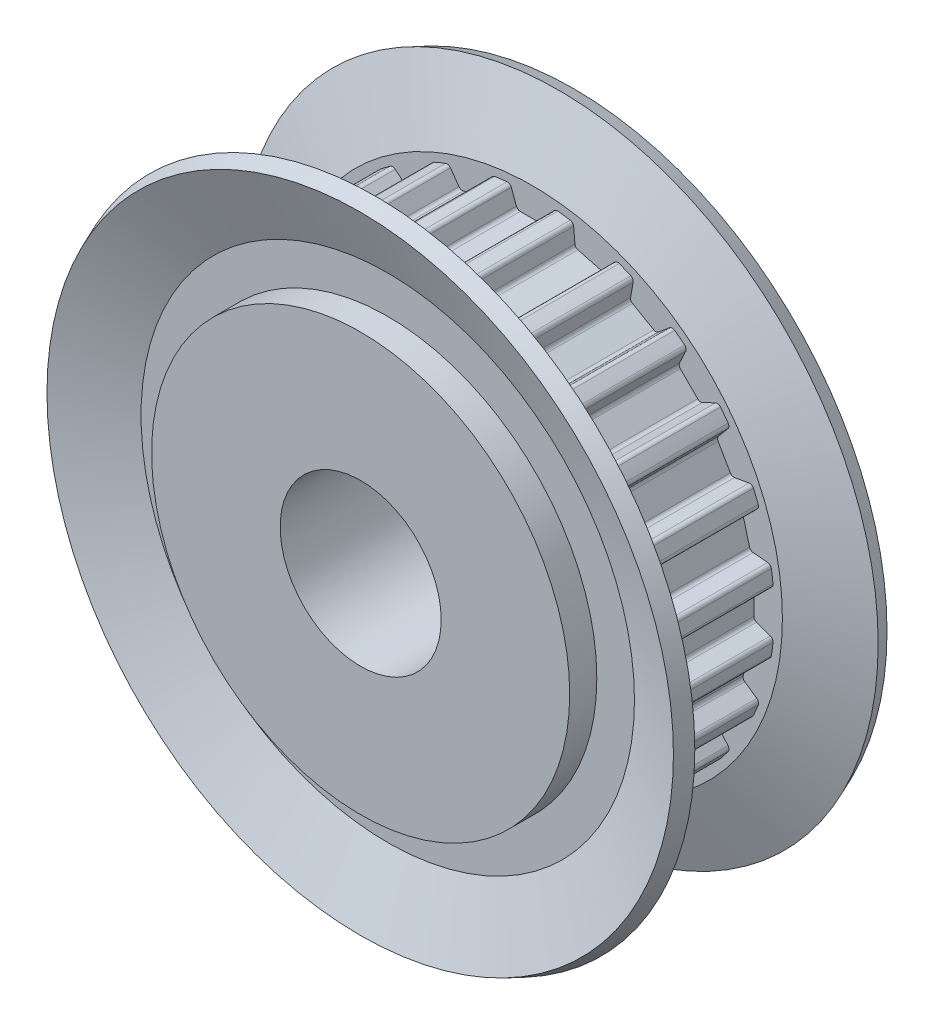
from build123d import *

# Parameters (mm, degrees)
TOOTHEXTRUDECUTGEARBELT01_DEPTH = 2.031999969
PATTERNGEARBELT01_COUNT         = 24
BOREREVOLVESKETCH_W             = 6.6039999
BOREREVOLVESKETCH_H             = 2.5


with BuildPart() as part:
    # SketchRevolveGearBelt01 → GearBelt01 (revolve)
    with BuildSketch(Plane(origin=(0, 0, 0), x_dir=(0, 0, -1), z_dir=(1, 0, 0))):
        Polygon((3.30199995, 0), (3.30199995, 6.491668167), (2.460624963, 6.491668167), (2.460624963, 7.660620667), (3.316242834, 9.726264935), (2.846912038, 9.920668116), (2.031999969, 7.761668148), (2.031999969, 7.511662937), (-2.031999969, 7.511662937), (-2.031999969, 7.761668148), (-2.846912038, 9.920668116), (-3.316242834, 9.726264935), (-2.460624963, 7.660620667), (-2.460624963, 6.491668167), (-3.30199995, 6.491668167), (-3.30199995, 0), align=None)
    revolve(axis=Axis((0, 0, 0), (0, 0, -1)))

    # SketchToothGearBelt01 → ToothExtrudeCutGearBelt01 (cut, symmetric)
    with BuildSketch(Plane.XY):
        with BuildLine():
            Line((-0.65453697, 7.387438169), (-0.499044598, 6.960226387))
            ThreePointArc((-0.499044598, 6.960226387), (-0.452547843, 6.899630636), (-0.379703637, 6.876662946))
            Line((-0.379703637, 6.876662946), (0.379703637, 6.876662946))
            ThreePointArc((0.379703637, 6.876662946), (0.452547843, 6.899630636), (0.499044598, 6.960226387))
            Line((0.499044598, 6.960226387), (0.65453697, 7.387438169))
            ThreePointArc((0.65453697, 7.387438169), (0.706592635, 7.451712745), (0.787186934, 7.470302324))
            Line((0.787186934, 7.470302324), (0, 10.010302286))
            Line((0, 10.010302286), (-0.787186934, 7.470302324))
            ThreePointArc((-0.787186934, 7.470302324), (-0.706592635, 7.451712745), (-0.65453697, 7.387438169))
        make_face()
    toothextrudecutgearbelt01 = extrude(amount=TOOTHEXTRUDECUTGEARBELT01_DEPTH, both=True, mode=Mode.SUBTRACT)

    # PatternGearBelt01: ToothExtrudeCutGearBelt01 ×24 about axis
    patterngearbelt01_axis = Axis((0, 0, 55), (0, 0, -1))
    for i in range(1, PATTERNGEARBELT01_COUNT):
        add(toothextrudecutgearbelt01.rotate(patterngearbelt01_axis, i * 360 / PATTERNGEARBELT01_COUNT), mode=Mode.SUBTRACT)

    # BoreRevolveSketch → BoreRevolveCut (revolve, cut)
    with BuildSketch(Plane(origin=(0, 0, 0), x_dir=(0, 0, -1), z_dir=(1, 0, 0))):
        with Locations((0, 1.25)):
            Rectangle(BOREREVOLVESKETCH_W, BOREREVOLVESKETCH_H)
    revolve(axis=Axis((0, 0, 0), (0, 0, -1)), mode=Mode.SUBTRACT)


solid = part.part
